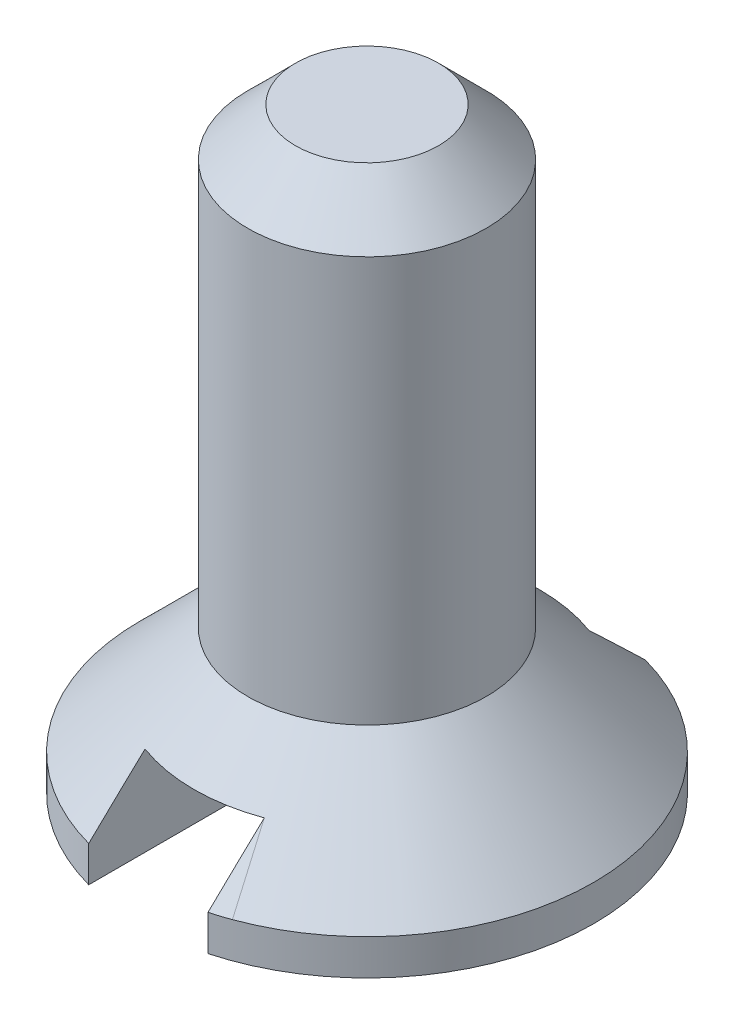
from build123d import *

# Parameters (mm, degrees)
SKETCH_1_W          = 1
SKETCH_1_H          = 3.8
SKETCH_2_W          = 1
SKETCH_2_H          = 0.75
CUT_EXTRUDE_1_DEPTH = 10
CHAMFER_1_SIZE      = 0.4


with BuildPart() as part:
    # Эскиз1 → Повернуть1 (revolve)
    with BuildSketch(Plane.XY):
        with Locations((-0.5, 3.1)):
            Rectangle(SKETCH_1_W, SKETCH_1_H)
        Polygon((-1.9, 0), (0, 0), (0, 1.2), (-1, 1.2), (-1.9, 0.3), align=None)
    revolve(axis=Axis((0, 5, 0), (0, -1, 0)))

    # Эскиз2 → Вырез-Вытянуть1 (cut, symmetric)
    with BuildSketch(Plane.XY):
        with Locations((0, 0.375)):
            Rectangle(SKETCH_2_W, SKETCH_2_H)
    extrude(amount=CUT_EXTRUDE_1_DEPTH, both=True, mode=Mode.SUBTRACT)

    # Фаска1
    chamfer_1_edges = [part.edges().sort_by_distance(p)[0] for p in [
        (1, 5, 0),
    ]]
    chamfer(chamfer_1_edges, length=CHAMFER_1_SIZE)


solid = part.part
